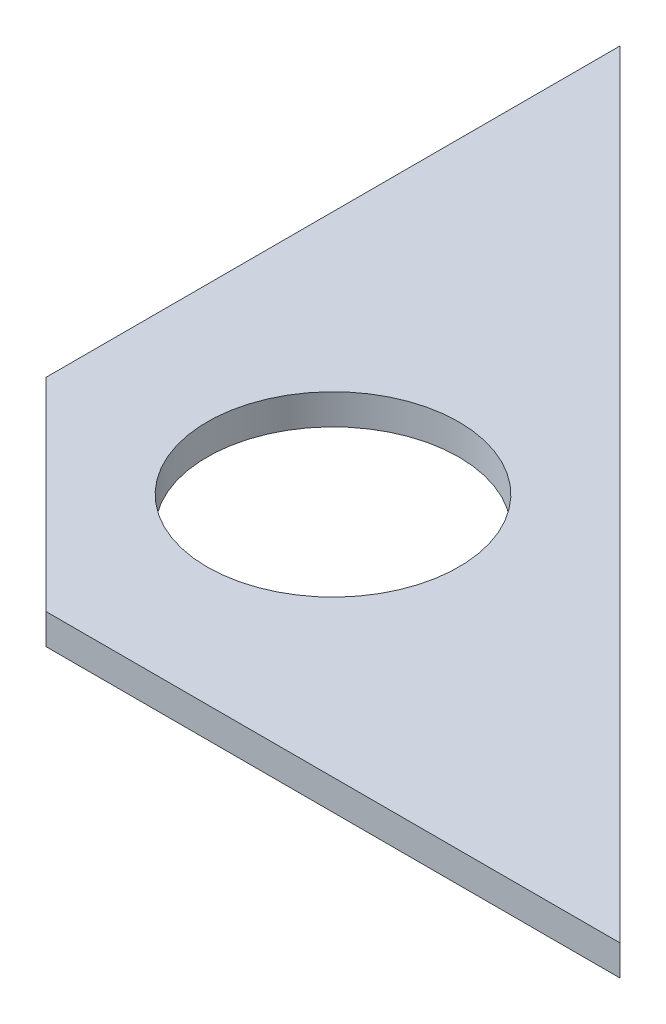
from build123d import *

# Parameters (mm, degrees)
SKETCH_1_R      = 12.4
EXTRUDE_1_DEPTH = 3


with BuildPart() as part:
    # 草圖1 → 填料-伸長1 (new body)
    with BuildSketch(Plane(origin=(0, 0, 0), x_dir=(1, 0, 0), z_dir=(0, 1, 0))):
        Polygon((0, 76.568542495), (0, 20), (20, 0), (76.568542495, 0), align=None)
        with Locations(Location((24.142135624, 24.142135624, 0), (0, 0, 270))):
            Circle(SKETCH_1_R, mode=Mode.SUBTRACT)
    extrude(amount=EXTRUDE_1_DEPTH)


solid = part.part
